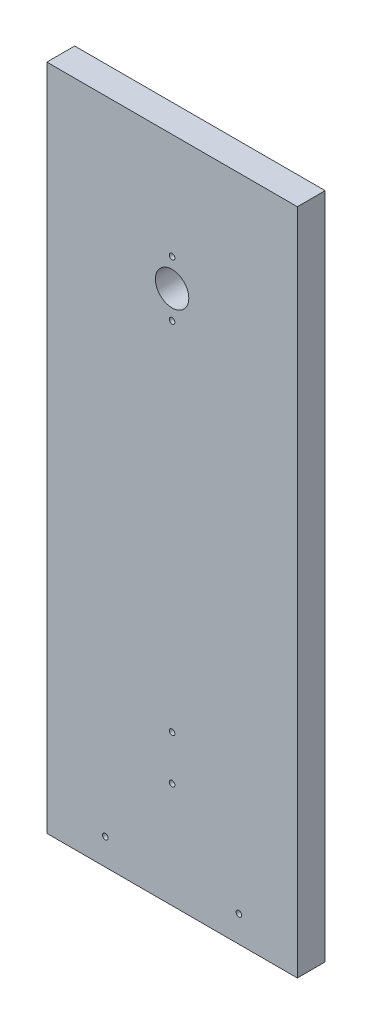
from build123d import *

# Parameters (mm, degrees)
ESQUISSE1_W                  = 90
ESQUISSE1_H                  = 240
BOSS_EXTRU_1_DEPTH           = 10
ENL_V_MAT_EXTRU_1_DEPTH      = 257.515106768
ENL_V_MAT_EXTRU_1_DEPTH_BACK = 257.515106768
ESQUISSE2_R                  = 1
ESQUISSE2_R_2                = 6


with BuildPart() as part:
    # Esquisse1 → Boss.-Extru.1 (new body)
    with BuildSketch(Plane.XY):
        with Locations((45, 120)):
            Rectangle(ESQUISSE1_W, ESQUISSE1_H)
    extrude(amount=BOSS_EXTRU_1_DEPTH)

    # Esquisse2 → Enlèv. mat.-Extru.1 (cut, two sides: drawn at the far end of the back side and taken through both)
    with BuildSketch(Plane.XY.offset(10).offset(-ENL_V_MAT_EXTRU_1_DEPTH_BACK)):
        with Locations((45, 54)):
            Circle(ESQUISSE2_R)
        with Locations((45, 38)):
            Circle(ESQUISSE2_R)
        with Locations((21, 9.5)):
            Circle(ESQUISSE2_R)
        with Locations(Location((69, 9.5, 0), (0, 0, 180))):
            Circle(ESQUISSE2_R)
        with Locations((45, 192)):
            Circle(ESQUISSE2_R_2)
        with Locations((45, 182)):
            Circle(ESQUISSE2_R)
        with Locations(Location((45, 202, 0), (0, 0, 180))):
            Circle(ESQUISSE2_R)
    extrude(amount=ENL_V_MAT_EXTRU_1_DEPTH + ENL_V_MAT_EXTRU_1_DEPTH_BACK, mode=Mode.SUBTRACT)


solid = part.part
